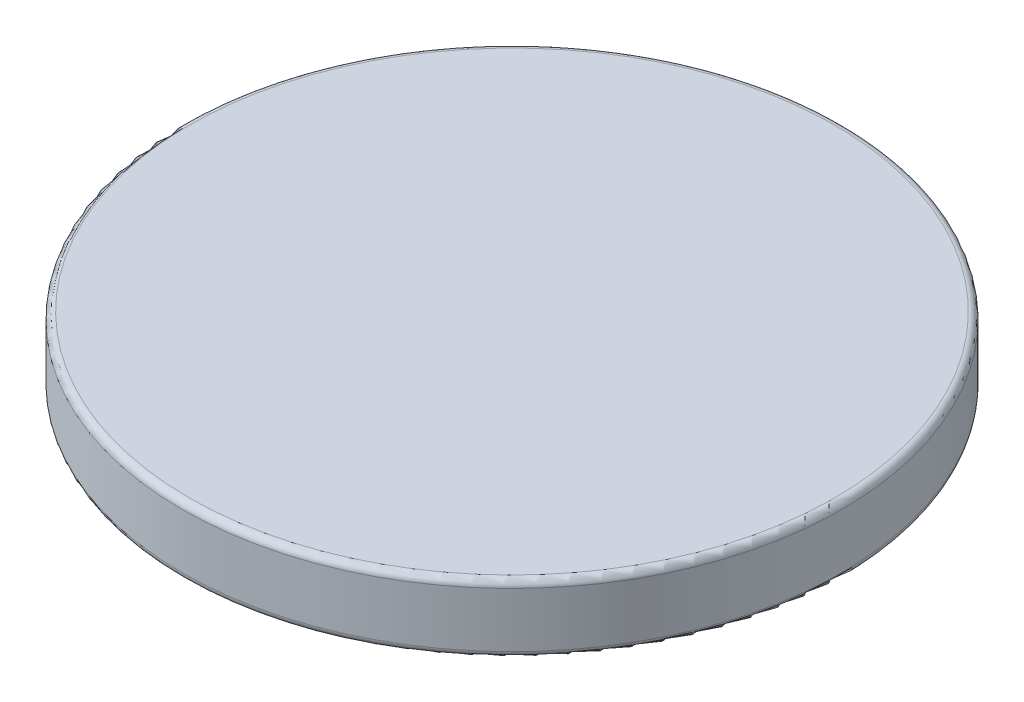
from build123d import *

# Parameters (mm, degrees)
SKETCH2_R           = 61.214
BOSS_EXTRUDE1_DEPTH = 12.7
FILLET1_R           = 1.27


with BuildPart() as part:
    # Sketch2 → Boss-Extrude1 (new body)
    with BuildSketch(Plane(origin=(0, 0, 0), x_dir=(1, 0, 0), z_dir=(0, 1, 0))):
        with Locations(Location((0, 0, 0), (0, 0, 270))):
            Circle(SKETCH2_R)
    extrude(amount=-BOSS_EXTRUDE1_DEPTH)

    # Fillet1
    fillet1_edges = [part.edges().sort_by_distance(p)[0] for p in [
        (0, 0, -61.214),
        (0, -12.7, -61.214),
    ]]
    fillet(fillet1_edges, radius=FILLET1_R)


solid = part.part
